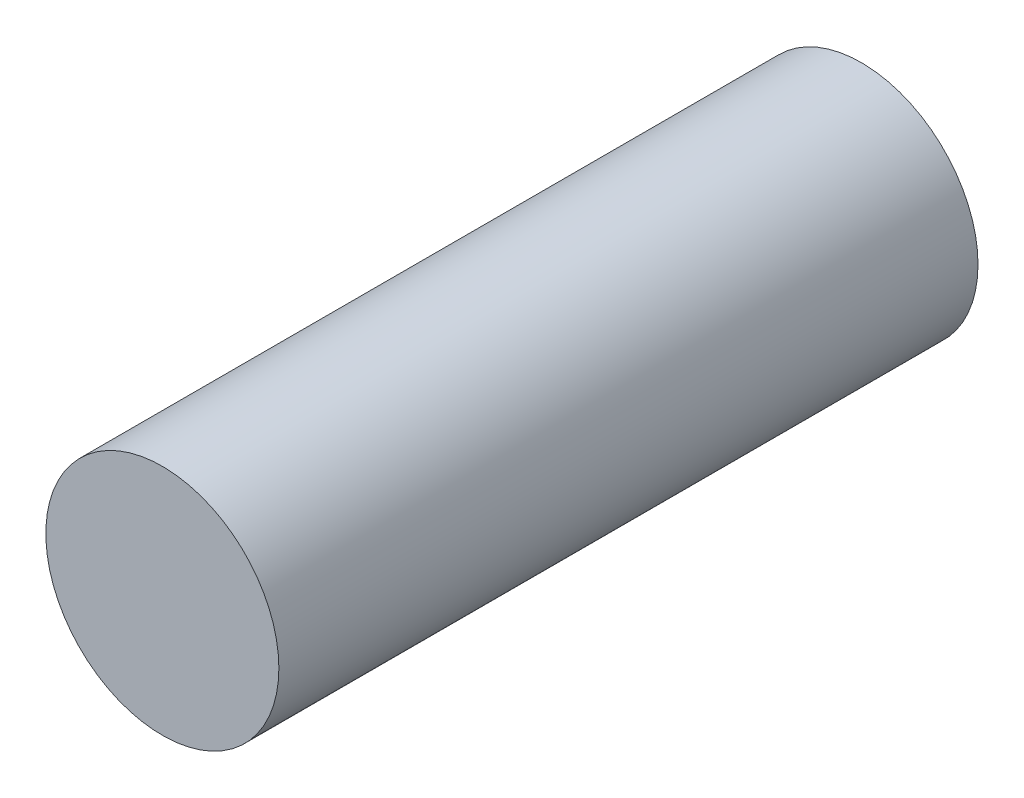
from build123d import *

# Parameters (mm, degrees)
SKETCH1_R           = 6.65
BOSS_EXTRUDE1_DEPTH = 39.9


with BuildPart() as part:
    # Sketch1 → Boss-Extrude1 (new body)
    with BuildSketch(Plane(origin=(0, 0, 0), x_dir=(0, 1, 0), z_dir=(0, 0, 1))):
        with Locations(Location((0, 0, 0), (0, 0, 270))):
            Circle(SKETCH1_R)
    extrude(amount=BOSS_EXTRUDE1_DEPTH)


solid = part.part
